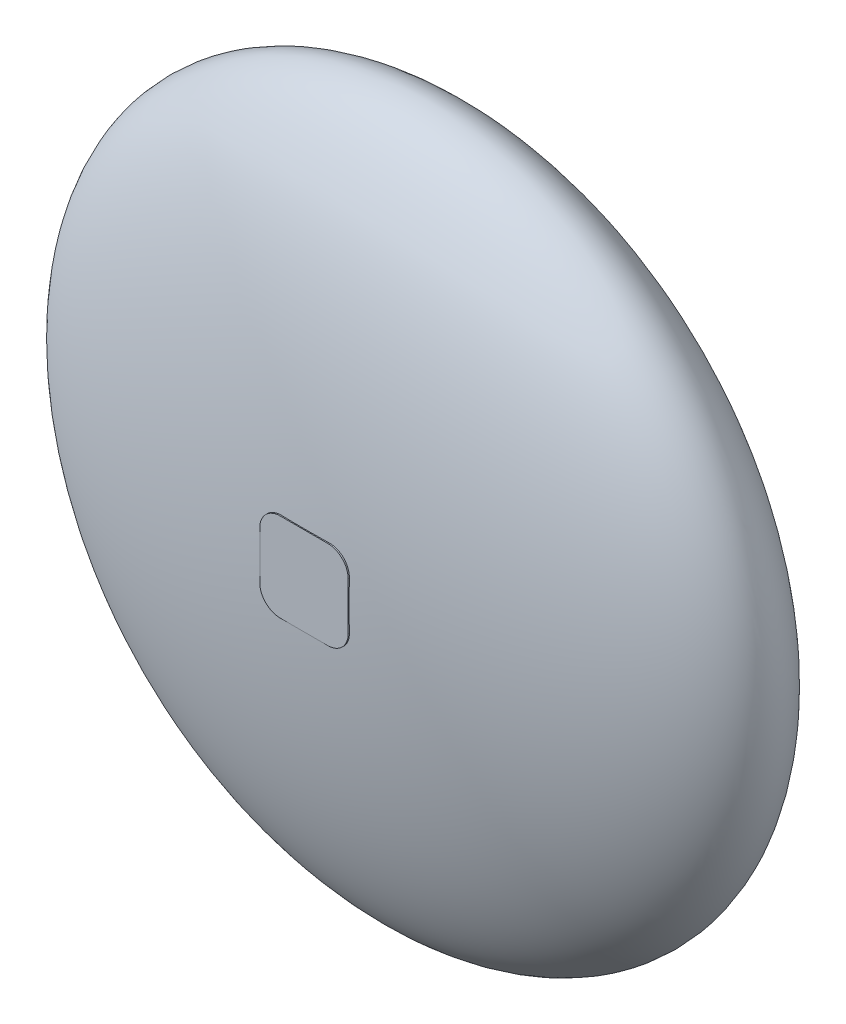
from build123d import *

# Parameters (mm, degrees)
SKETCH2_W           = 13
SKETCH2_H           = 13
BOSS_EXTRUDE1_DEPTH = 17.5
FILLET1_R           = 3
SKETCH3_R           = 4.6
SKETCH3_R_2         = 7
CUT_EXTRUDE1_DEPTH  = 16


with BuildPart() as part:
    # Sketch1 → Revolve4 (revolve)
    with BuildSketch(Plane(origin=(0, 0, 0), x_dir=(1, 0, 0), z_dir=(0, 1, 0))):
        with BuildLine():
            Line((0, 17.5), (0, -17.5))
            add(Edge.make_bspline(
                [(0, -17.5), (52.5, -17.5), (52.5, 0), (52.5, 17.5), (0, 17.5)],
                knots=[1.570796327, 1.570796327, 1.570796327, 3.141592654, 3.141592654, 4.71238898, 4.71238898, 4.71238898], degree=2, weights=[1, 0.707106781, 1, 0.707106781, 1]))
        make_face()
    revolve(axis=Axis((0, 0, -17.5), (0, 0, 1)))

    # Sketch2 → Boss-Extrude1 (add, through all)
    with BuildSketch(Plane.XY):
        Rectangle(SKETCH2_W, SKETCH2_H)
    extrude(amount=BOSS_EXTRUDE1_DEPTH)

    # Fillet1
    fillet1_edges = [part.edges().sort_by_distance(p)[0] for p in [
        (6.5, -6.5, 17.364828947),
        (-6.5, 6.5, 17.364828947),
        (6.5, 6.5, 17.364828947),
        (-6.5, -6.5, 17.364828947),
    ]]
    fillet(fillet1_edges, radius=FILLET1_R)

    # Sketch3 → Cut-Extrude1 (cut)
    with BuildSketch(Plane.XY.offset(8)):
        with Locations((0, 14)):
            Circle(SKETCH3_R)
        with Locations((10.945640755, 8.728857226)):
            Circle(SKETCH3_R)
        with Locations((13.648990771, -3.115293075)):
            Circle(SKETCH3_R)
        with Locations((6.074372348, -12.613564151)):
            Circle(SKETCH3_R)
        with Locations((-6.074372348, -12.613564151)):
            Circle(SKETCH3_R)
        with Locations((-13.648990771, -3.115293075)):
            Circle(SKETCH3_R)
        with Locations((-10.945640755, 8.728857226)):
            Circle(SKETCH3_R)
        Circle(SKETCH3_R_2)
    extrude(amount=-CUT_EXTRUDE1_DEPTH, mode=Mode.SUBTRACT)


solid = part.part
